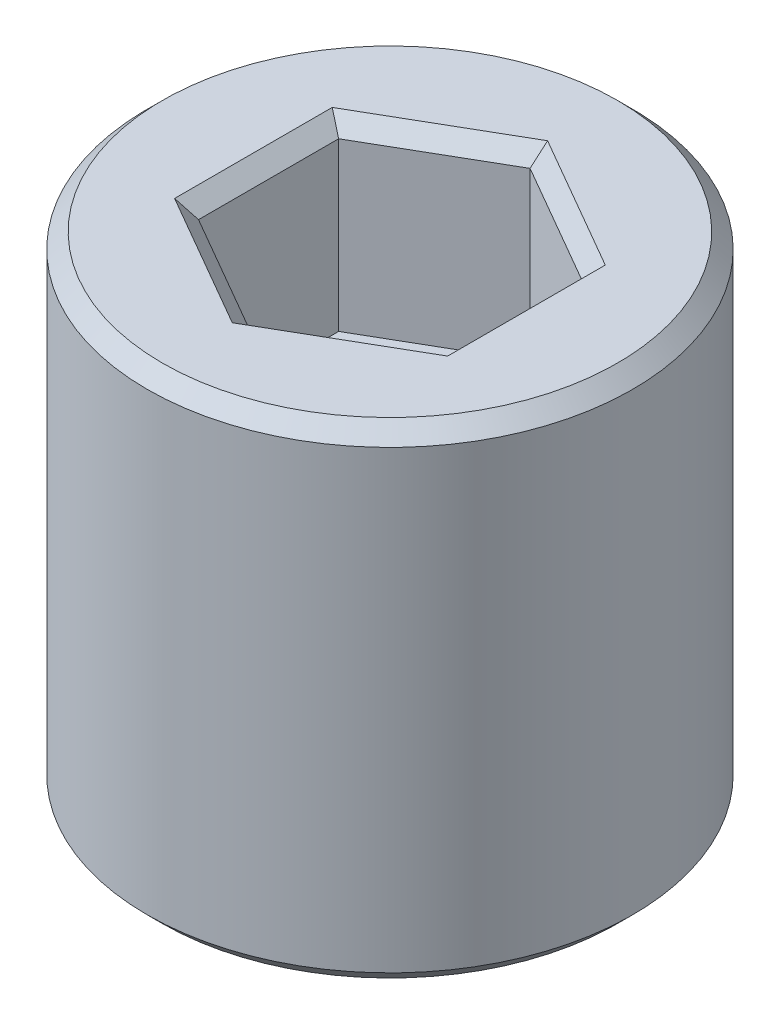
from build123d import *

# Parameters (mm, degrees)
SKETCH1_R           = 4
BOSS_EXTRUDE1_DEPTH = 8
CHAMFER1_SIZE       = 0.25
CUT_EXTRUDE1_DEPTH  = 3
CHAMFER2_SIZE       = 0.25


with BuildPart() as part:
    # Sketch1 → Boss-Extrude1 (new body)
    with BuildSketch(Plane(origin=(0, 0, 0), x_dir=(1, 0, 0), z_dir=(0, 1, 0))):
        with Locations(Location((0, 0, 0), (0, 0, 270))):
            Circle(SKETCH1_R)
    extrude(amount=-BOSS_EXTRUDE1_DEPTH)

    # Chamfer1
    chamfer1_edges = [part.edges().sort_by_distance(p)[0] for p in [
        (0, 0, -4),
        (0, -8, -4),
    ]]
    chamfer(chamfer1_edges, length=CHAMFER1_SIZE)

    # Sketch2 → Cut-Extrude1 (cut)
    with BuildSketch(Plane(origin=(0, 0, 0), x_dir=(1, 0, 0), z_dir=(0, 1, 0))):
        Polygon((0, 2.309401077), (2, 1.154700538), (2, -1.154700538), (0, -2.309401077), (-2, -1.154700538), (-2, 1.154700538), align=None)
    extrude(amount=-CUT_EXTRUDE1_DEPTH, mode=Mode.SUBTRACT)

    # Chamfer2
    chamfer2_edges = [part.edges().sort_by_distance(p)[0] for p in [
        (-1, 0, -1.732050808),
        (-2, 0, 0),
        (-1, 0, 1.732050808),
        (1, 0, 1.732050808),
        (2, 0, 0),
        (1, 0, -1.732050808),
    ]]
    chamfer(chamfer2_edges, length=CHAMFER2_SIZE)


solid = part.part
